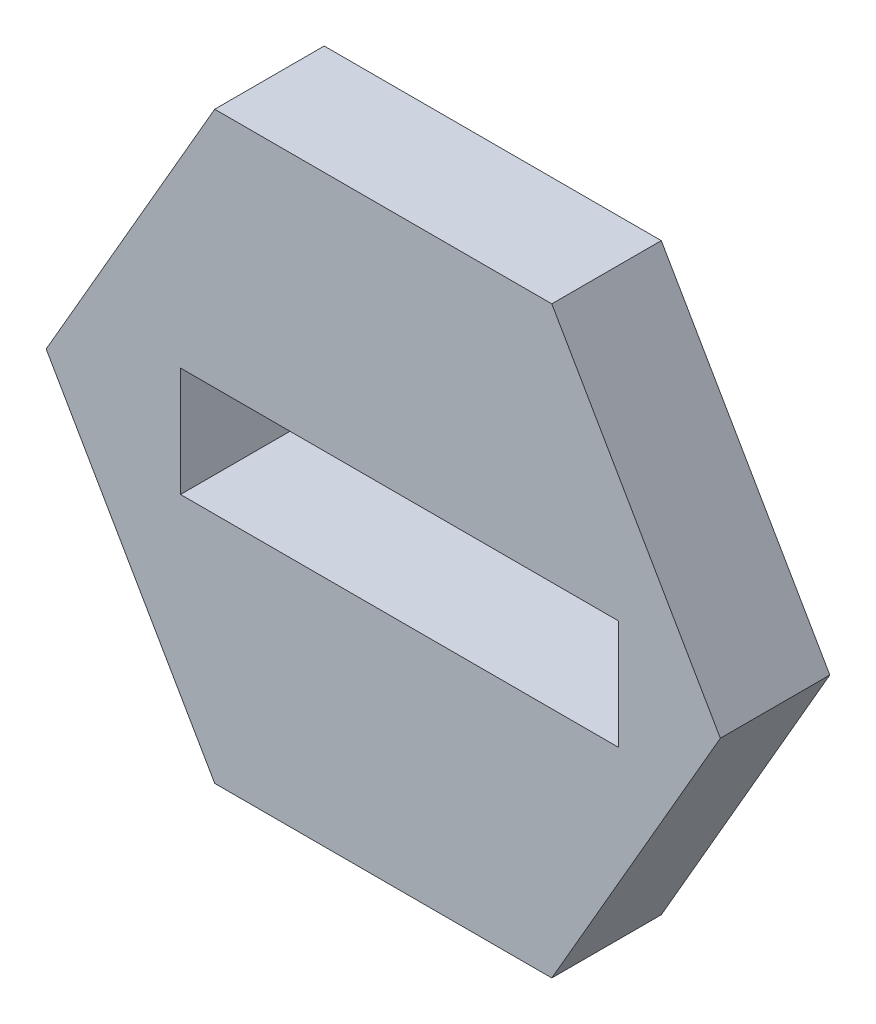
from build123d import *

# Parameters (mm, degrees)
SKETCH1_W          = 12
SKETCH1_H          = 3
BASE_EXTRUDE_DEPTH = 3


with BuildPart() as part:
    # Sketch1 → Base-Extrude (new body)
    with BuildSketch(Plane.XY):
        Polygon((-10.001783731, 5.694807634), (-14.619662064, 13.693207531), (-23.85541873, 13.693207531), (-28.473297063, 5.694807634), (-23.85541873, -2.303592262), (-14.619662064, -2.303592262), align=None)
        with Locations((-18.791830986, 5.583380282)):
            Rectangle(SKETCH1_W, SKETCH1_H, mode=Mode.SUBTRACT)
    extrude(amount=BASE_EXTRUDE_DEPTH)


solid = part.part
